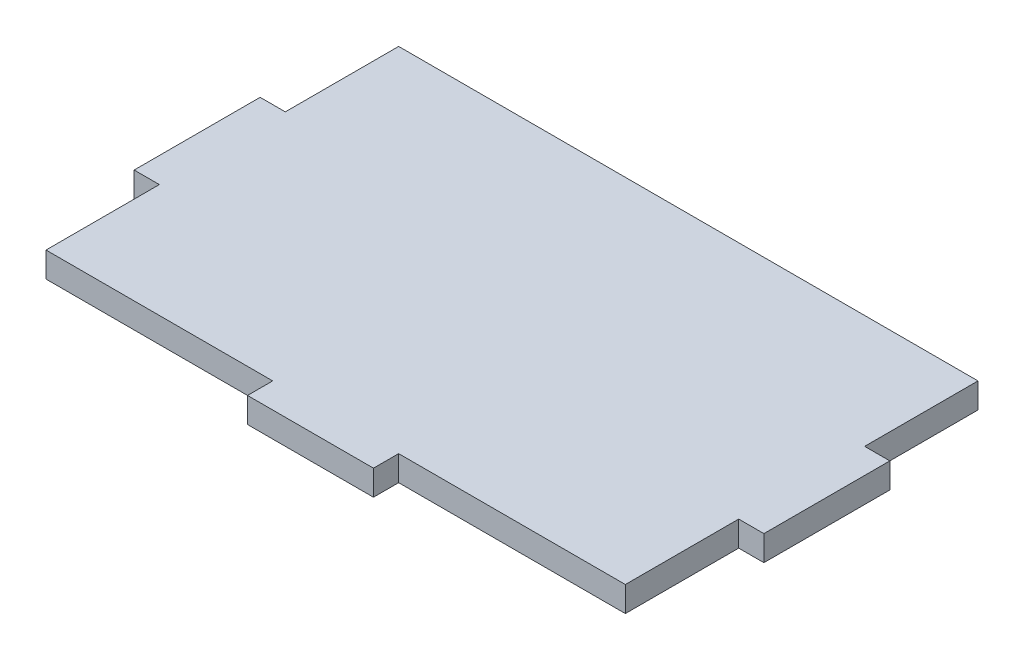
from build123d import *

# Parameters (mm, degrees)
SKETCH_1_W      = 92
SKETCH_1_H      = 56
SKETCH_1_W_2    = 4
SKETCH_1_H_2    = 20
SKETCH_1_W_3    = 20
SKETCH_1_H_3    = 4
EXTRUDE_2_DEPTH = 4


with BuildPart() as part:
    # 草图1 → 凸台-拉伸2 (new body)
    with BuildSketch(Plane(origin=(0, 0, 0), x_dir=(1, 0, 0), z_dir=(0, 1, 0))):
        with Locations((46, 28)):
            Rectangle(SKETCH_1_W, SKETCH_1_H)
        with Locations((-2, 28)):
            Rectangle(SKETCH_1_W_2, SKETCH_1_H_2)
        with Locations((94, 28)):
            Rectangle(SKETCH_1_W_2, SKETCH_1_H_2)
        with Locations((46, -2)):
            Rectangle(SKETCH_1_W_3, SKETCH_1_H_3)
    extrude(amount=EXTRUDE_2_DEPTH)


solid = part.part
